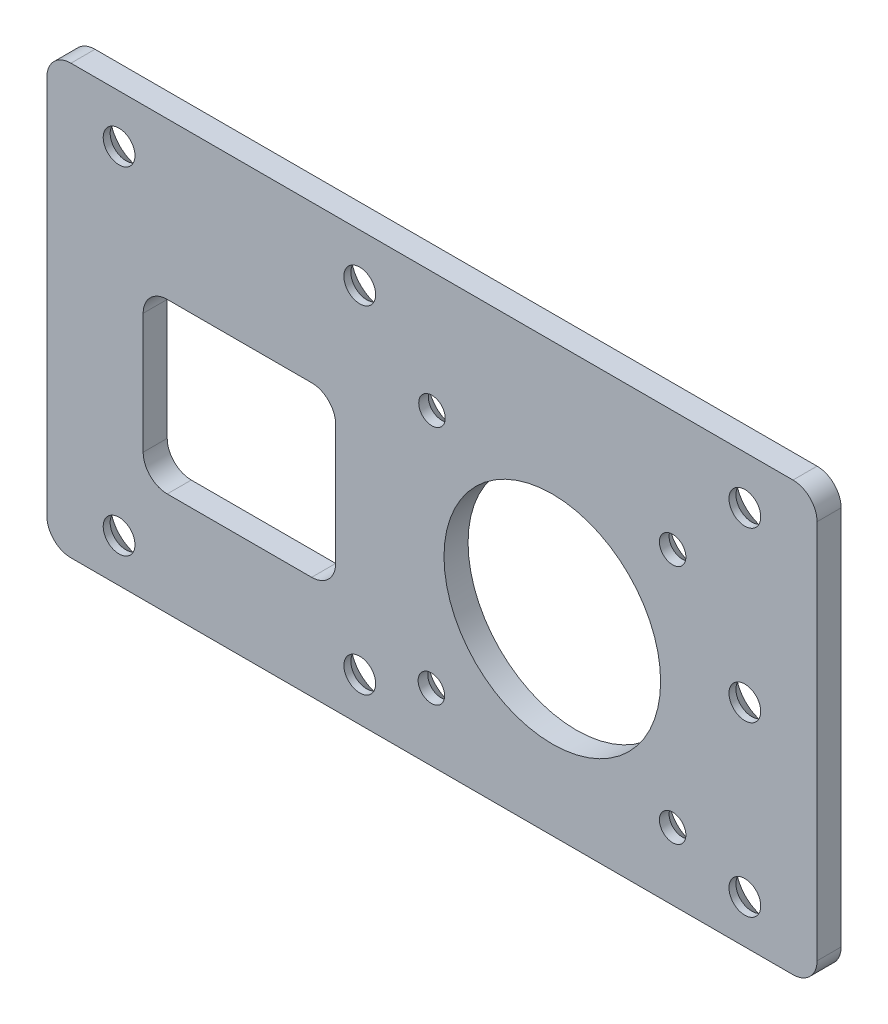
from build123d import *

# Parameters (mm, degrees)
SKETCH_1_W                 = 160
SKETCH_1_H                 = 89
EXTRUDE_1_DEPTH            = 5
SKETCH_2_R                 = 22.5
CUT_EXTRUDE_1_DEPTH        = 10
HOLE_WIZARD_M61_AT_2_COUNT = 2
HOLE_WIZARD_M61_AT_2_PITCH = 35
HOLE_WIZARD_M61_AT_3_COUNT = 2
HOLE_WIZARD_M61_AT_3_PITCH = 70
HOLE_WIZARD_M61_AT_4_COUNT = 2
HOLE_WIZARD_M61_AT_4_PITCH = 106.301458127
HOLE_WIZARD_M61_AT_5_COUNT = 2
HOLE_WIZARD_M61_AT_5_PITCH = 80
HOLE_WIZARD_M61_AT_6_COUNT = 2
HOLE_WIZARD_M61_AT_6_PITCH = 130
HOLE_WIZARD_M61_AT_7_COUNT = 2
HOLE_WIZARD_M61_AT_7_PITCH = 147.648230602
HOLE_WIZARD_M51_AT_2_COUNT = 2
HOLE_WIZARD_M51_AT_2_PITCH = 50
HOLE_WIZARD_M51_AT_3_COUNT = 2
HOLE_WIZARD_M51_AT_3_PITCH = 70.799083017
HOLE_WIZARD_M51_AT_4_COUNT = 2
HOLE_WIZARD_M51_AT_4_PITCH = 50
SKETCH_12_W                = 40
SKETCH_12_H                = 35
CUT_EXTRUDE_2_DEPTH        = 10
FILLET_1_R                 = 5


with BuildPart() as part:
    # Эскиз1 → Бобышка-Вытянуть1 (new body)
    with BuildSketch(Plane.XY):
        with Locations((-25, 5.5)):
            Rectangle(SKETCH_1_W, SKETCH_1_H)
    extrude(amount=EXTRUDE_1_DEPTH)

    # Эскиз2 → Вырез-Вытянуть1 (cut)
    with BuildSketch(Plane.XY.offset(5)):
        Circle(SKETCH_2_R)
    extrude(amount=-CUT_EXTRUDE_1_DEPTH, mode=Mode.SUBTRACT)

    # Эскиз7 → Зенковка для винта с потайной головкой и внутренним шестигранником M61 (revolve, cut)
    with BuildSketch(Plane(origin=(40, -30, 0), x_dir=(0, 1, 0), z_dir=(1, 0, 0))):
        Polygon((0, 0), (0, 5), (3.3, 5), (3.3, 3.555), (6.855, 0), align=None)
    hole_wizard_m61 = revolve(axis=Axis((40, -30, -6.35), (0, 0, 1)), mode=Mode.SUBTRACT)

    # Зенковка для винта с потайной головкой и внутренним шестигранником M61 at 2: Зенковка для винта с потайной головкой и внутренним шестигранником M61 ×2
    with Locations(*[(0, i * HOLE_WIZARD_M61_AT_2_PITCH, 0) for i in range(1, HOLE_WIZARD_M61_AT_2_COUNT)]):
        add(hole_wizard_m61, mode=Mode.SUBTRACT)

    # Зенковка для винта с потайной головкой и внутренним шестигранником M61 at 3: Зенковка для винта с потайной головкой и внутренним шестигранником M61 ×2
    with Locations(*[(0, i * HOLE_WIZARD_M61_AT_3_PITCH, 0) for i in range(1, HOLE_WIZARD_M61_AT_3_COUNT)]):
        add(hole_wizard_m61, mode=Mode.SUBTRACT)

    # Зенковка для винта с потайной головкой и внутренним шестигранником M61 at 4: Зенковка для винта с потайной головкой и внутренним шестигранником M61 ×2
    with Locations(*[Vector(-0.7525766947068778, 0.6585046078685182, 0) * (i * HOLE_WIZARD_M61_AT_4_PITCH) for i in range(1, HOLE_WIZARD_M61_AT_4_COUNT)]):
        add(hole_wizard_m61, mode=Mode.SUBTRACT)

    # Зенковка для винта с потайной головкой и внутренним шестигранником M61 at 5: Зенковка для винта с потайной головкой и внутренним шестигранником M61 ×2
    with Locations(*[(-i * HOLE_WIZARD_M61_AT_5_PITCH, 0, 0) for i in range(1, HOLE_WIZARD_M61_AT_5_COUNT)]):
        add(hole_wizard_m61, mode=Mode.SUBTRACT)

    # Зенковка для винта с потайной головкой и внутренним шестигранником M61 at 6: Зенковка для винта с потайной головкой и внутренним шестигранником M61 ×2
    with Locations(*[(-i * HOLE_WIZARD_M61_AT_6_PITCH, 0, 0) for i in range(1, HOLE_WIZARD_M61_AT_6_COUNT)]):
        add(hole_wizard_m61, mode=Mode.SUBTRACT)

    # Зенковка для винта с потайной головкой и внутренним шестигранником M61 at 7: Зенковка для винта с потайной головкой и внутренним шестигранником M61 ×2
    with Locations(*[Vector(-0.8804710999221753, 0.47409982303501746, 0) * (i * HOLE_WIZARD_M61_AT_7_PITCH) for i in range(1, HOLE_WIZARD_M61_AT_7_COUNT)]):
        add(hole_wizard_m61, mode=Mode.SUBTRACT)

    # Эскиз10 → Зенковка для винта с потайной головкой и внутренним шестигранником M51 (revolve, cut)
    with BuildSketch(Plane(origin=(25, 25, 0), x_dir=(0, 1, 0), z_dir=(1, 0, 0))):
        Polygon((0, 0), (0, 5), (2.75, 5), (2.75, 2.985), (5.735, 0), align=None)
    hole_wizard_m51 = revolve(axis=Axis((25, 25, -6.35), (0, 0, 1)), mode=Mode.SUBTRACT)

    # Зенковка для винта с потайной головкой и внутренним шестигранником M51 at 2: Зенковка для винта с потайной головкой и внутренним шестигранником M51 ×2
    with Locations(*[(0, -i * HOLE_WIZARD_M51_AT_2_PITCH, 0) for i in range(1, HOLE_WIZARD_M51_AT_2_COUNT)]):
        add(hole_wizard_m51, mode=Mode.SUBTRACT)

    # Зенковка для винта с потайной головкой и внутренним шестигранником M51 at 3: Зенковка для винта с потайной головкой и внутренним шестигранником M51 ×2
    with Locations(*[Vector(-0.7079886251428247, -0.7062238360947419, 0) * (i * HOLE_WIZARD_M51_AT_3_PITCH) for i in range(1, HOLE_WIZARD_M51_AT_3_COUNT)]):
        add(hole_wizard_m51, mode=Mode.SUBTRACT)

    # Зенковка для винта с потайной головкой и внутренним шестигранником M51 at 4: Зенковка для винта с потайной головкой и внутренним шестигранником M51 ×2
    with Locations(*[(-i * HOLE_WIZARD_M51_AT_4_PITCH, 0, 0) for i in range(1, HOLE_WIZARD_M51_AT_4_COUNT)]):
        add(hole_wizard_m51, mode=Mode.SUBTRACT)

    # Эскиз12 → Вырез-Вытянуть2 (cut)
    with BuildSketch(Plane(origin=(0, 0, 0), x_dir=(-1, 0, 0), z_dir=(0, 0, -1))):
        with Locations((65, 0)):
            Rectangle(SKETCH_12_W, SKETCH_12_H)
    extrude(amount=-CUT_EXTRUDE_2_DEPTH, mode=Mode.SUBTRACT)

    # Скругление1
    fillet_1_edges = [part.edges().sort_by_distance(p)[0] for p in [
        (-45, -17.5, 2.5),
        (-45, 17.5, 2.5),
        (-85, 17.5, 2.5),
        (-85, -17.5, 2.5),
        (55, -39, 2.5),
        (-105, -39, 2.5),
        (-105, 50, 2.5),
        (55, 50, 2.5),
    ]]
    fillet(fillet_1_edges, radius=FILLET_1_R)


solid = part.part
